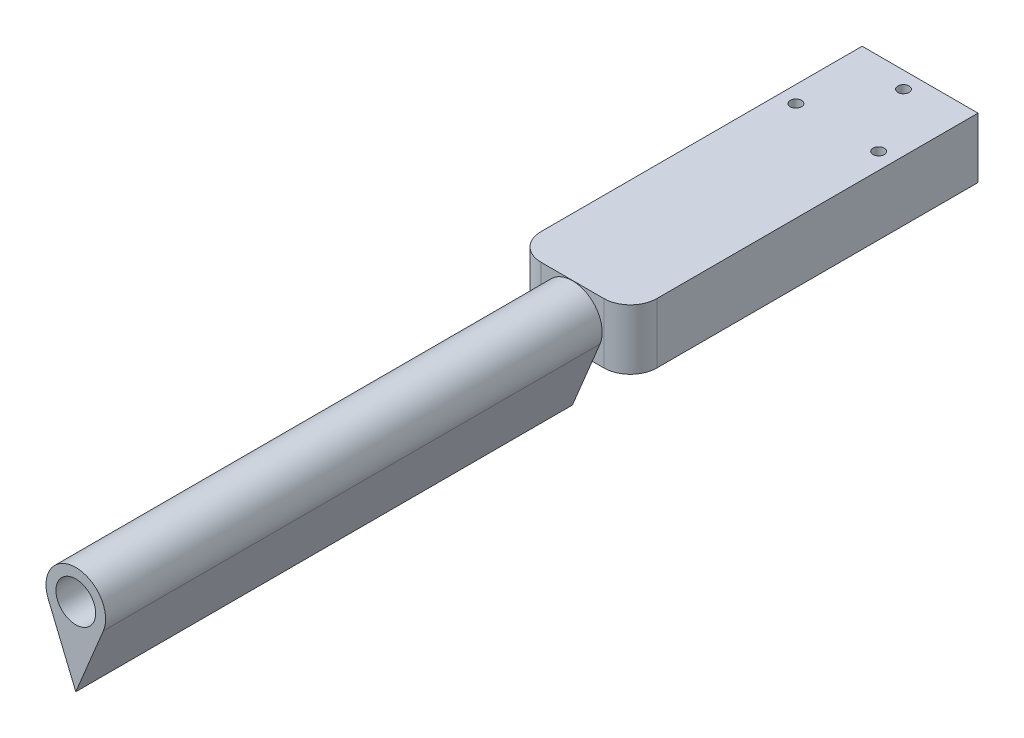
from build123d import *

# Parameters (mm, degrees)
IZIM1_R                     = 6
Y_KSEKLIK_EKSTR_ZYON1_DEPTH = 150
IZIM2_W                     = 35
IZIM2_H                     = 18.169429668
Y_KSEKLIK_EKSTR_ZYON2_DEPTH = 105
RADYUS1_R                   = 8
M3_BO_LUKLU_DELIK1_D        = 3.4
KES_EKSTR_ZYON1_START       = -105
IZIM8_R                     = 6
KES_EKSTR_ZYON1_DEPTH       = 105
IZIM9_R                     = 6.319148562
KES_EKSTR_ZYON2_DEPTH       = 10


with BuildPart() as part:
    # Çizim1 → Yükseklik-Ekstrüzyon1 (new body)
    with BuildSketch(Plane.XY):
        with BuildLine():
            Line((0, -23.530781845), (8.315682398, -3.44229956))
            ThreePointArc((8.315682398, -3.44229956), (0, 9), (-8.315682398, -3.44229956))
            Line((-8.315682398, -3.44229956), (0, -23.530781845))
        make_face()
        Circle(IZIM1_R, mode=Mode.SUBTRACT)
    extrude(amount=Y_KSEKLIK_EKSTR_ZYON1_DEPTH)

    # Çizim2 → Yükseklik-Ekstrüzyon2 (add)
    with BuildSketch(Plane.XY):
        Rectangle(IZIM2_W, IZIM2_H)
    extrude(amount=-Y_KSEKLIK_EKSTR_ZYON2_DEPTH)

    # Radyus1
    radyus1_edges = [part.edges().sort_by_distance(p)[0] for p in [
        (17.5, 0, 0),
        (-17.5, 0, 0),
    ]]
    fillet(radyus1_edges, radius=RADYUS1_R)

    # M3 Boşluklu Delik1 (through all)
    with Locations(Plane(origin=(0, 9.084714834, 0), x_dir=(1, 0, 0), z_dir=(0, 1, 0))):
        with Locations((-12.5, 80), (12.5, 80), (0, 100)):
            Hole(M3_BO_LUKLU_DELIK1_D / 2)

    # Çizim8 → Kes-Ekstrüzyon1 (cut)
    with BuildSketch(Plane.XY.offset(KES_EKSTR_ZYON1_START)):
        Circle(IZIM8_R)
    extrude(amount=KES_EKSTR_ZYON1_DEPTH, mode=Mode.SUBTRACT)

    # Çizim9 → Kes-Ekstrüzyon2 (cut)
    with BuildSketch(Plane.XZ.offset(9.084714834)):
        with Locations(Location((0, -11.539481772, 0), (0, 0, 270))):
            Circle(IZIM9_R)
    extrude(amount=-KES_EKSTR_ZYON2_DEPTH, mode=Mode.SUBTRACT)


solid = part.part
